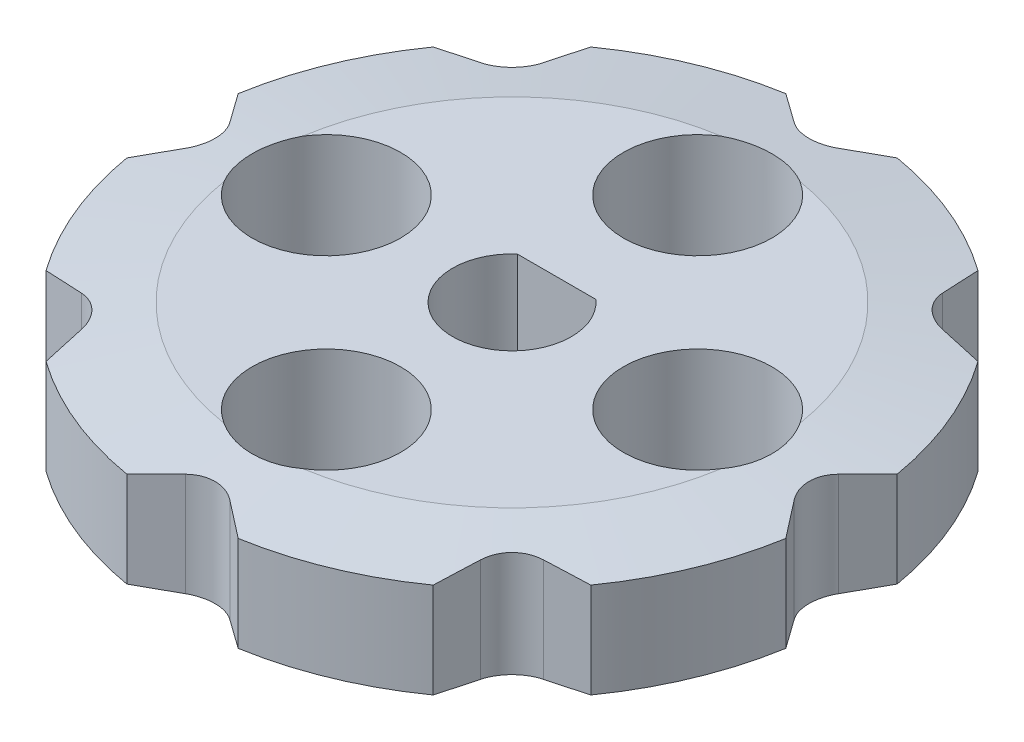
from build123d import *

# Parameters (mm, degrees)
SKETCH_1_R               = 9
EXTRUDE_1_DEPTH          = 3.2
CUT_EXTRUDE_2_REACH      = 15.124
PATTERN_CIRCULAR_1_COUNT = 8
CUT_EXTRUDE_1_REACH      = 14.951
SKETCH_3_R               = 2
PATTERN_CIRCULAR_2_COUNT = 4


with BuildPart() as part:
    # 草图1 → 凸台-拉伸1 (new body)
    with BuildSketch(Plane(origin=(0, 0, 0), x_dir=(1, 0, 0), z_dir=(0, 1, 0))):
        with Locations(Location((0, 0, 0), (0, 0, 270))):
            Circle(SKETCH_1_R)
        with BuildLine():
            Line((-1.058300524, 1.2), (1.058300524, 1.2))
            ThreePointArc((1.058300524, 1.2), (0, -1.6), (-1.058300524, 1.2))
        make_face(mode=Mode.SUBTRACT)
    extrude(amount=EXTRUDE_1_DEPTH)

    # 草图4 → 切除-拉伸2 (cut, up to next)
    with BuildSketch(Plane(origin=(0, 3.2, 0), x_dir=(1, 0, 0), z_dir=(0, 1, 0)), mode=Mode.PRIVATE) as cut_extrude_2_sk1:
        with BuildLine():
            Line((-1.5, 8.874119675), (-0.599498979, 8.19962448))
            ThreePointArc((-0.599498979, 8.19962448), (0, 8), (0.599498979, 8.19962448))
            Line((0.599498979, 8.19962448), (1.5, 8.874119675))
            ThreePointArc((1.5, 8.874119675), (0, 9), (-1.5, 8.874119675))
        make_face()
    cut_extrude_2_tool1 = extrude(cut_extrude_2_sk1.sketch, amount=-CUT_EXTRUDE_2_REACH, mode=Mode.PRIVATE) & part.part
    cut_extrude_2 = cut_extrude_2_tool1.solids().sort_by_distance((0, 3.2, -8.590322))[0]
    add(cut_extrude_2, mode=Mode.SUBTRACT)

    # 阵列(圆周)1: 切除-拉伸2 ×8 about axis
    pattern_circular_1_axis = Axis((0, 0, 0), (0, 1, 0))
    for i in range(1, PATTERN_CIRCULAR_1_COUNT):
        add(cut_extrude_2.rotate(pattern_circular_1_axis, i * 360 / PATTERN_CIRCULAR_1_COUNT), mode=Mode.SUBTRACT)

    # 草图3 → 切除-拉伸1 (cut, up to next)
    with BuildSketch(Plane(origin=(0, 3.2, 0), x_dir=(1, 0, 0), z_dir=(0, 1, 0)), mode=Mode.PRIVATE) as cut_extrude_1_sk1:
        with Locations(Location((0, 5, 0), (0, 0, 270))):
            Circle(SKETCH_3_R)
    cut_extrude_1_tool1 = extrude(cut_extrude_1_sk1.sketch, amount=-CUT_EXTRUDE_1_REACH, mode=Mode.PRIVATE) & part.part
    cut_extrude_1 = cut_extrude_1_tool1.solids().sort_by_distance((0, 3.2, -5))[0]
    add(cut_extrude_1, mode=Mode.SUBTRACT)

    # 阵列(圆周)2: 切除-拉伸1 ×4 about axis
    pattern_circular_2_axis = Axis((0, 0, 0), (0, 1, 0))
    for i in range(1, PATTERN_CIRCULAR_2_COUNT):
        add(cut_extrude_1.rotate(pattern_circular_2_axis, i * 360 / PATTERN_CIRCULAR_2_COUNT), mode=Mode.SUBTRACT)

    # 草图5 → 切除-旋转1 (revolve, cut)
    with BuildSketch(Plane(origin=(0, 0, 0), x_dir=(0, 0, -1), z_dir=(1, 0, 0)), mode=Mode.PRIVATE) as cut_revolve_1_sk:
        Polygon((9.374119675, 2.82841307), (6.778765119, 3.2), (9.374119675, 3.2), align=None)
    cut_revolve_1 = revolve(cut_revolve_1_sk.sketch.rotate(Axis((0, 3.2, 0), (0, -1, 0)), 4.181624795), axis=Axis((0, 3.2, 0), (0, -1, 0)), mode=Mode.SUBTRACT)

    # 镜向1: 切除-旋转1 across plane
    add(cut_revolve_1.mirror(Plane.ZX.offset(1.6)), mode=Mode.SUBTRACT)


solid = part.part
